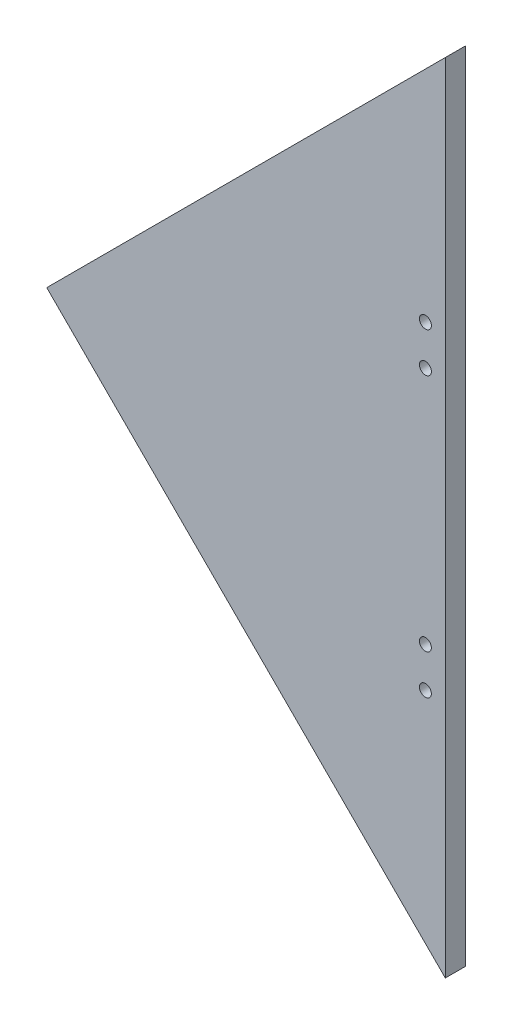
from build123d import *

# Parameters (mm, degrees)
SKETCH2_R           = 1.5
BOSS_EXTRUDE1_DEPTH = 5


with BuildPart() as part:
    # Sketch2 → Boss-Extrude1 (new body)
    with BuildSketch(Plane.XY):
        Polygon((0, -100), (0, 100), (-100, 0), align=None)
        with Locations((-5, 40)):
            Circle(SKETCH2_R, mode=Mode.SUBTRACT)
        with Locations((-5, 30)):
            Circle(SKETCH2_R, mode=Mode.SUBTRACT)
        with Locations((-5, -30)):
            Circle(SKETCH2_R, mode=Mode.SUBTRACT)
        with Locations((-5, -40)):
            Circle(SKETCH2_R, mode=Mode.SUBTRACT)
    extrude(amount=BOSS_EXTRUDE1_DEPTH)


solid = part.part
